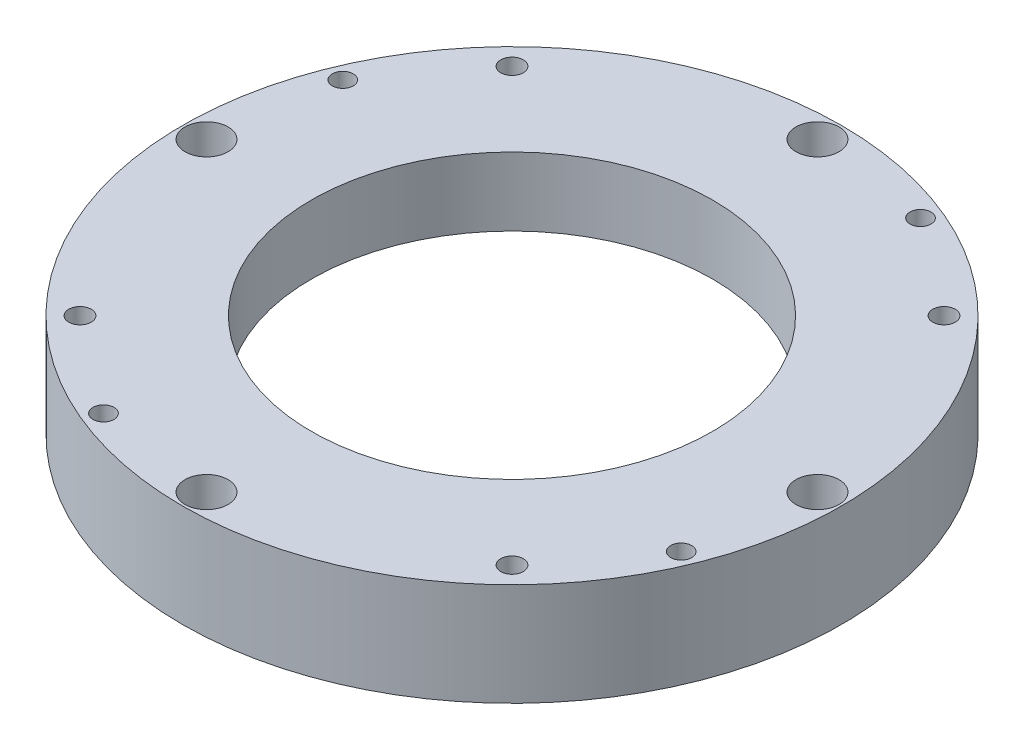
from build123d import *

# Parameters (mm, degrees)
SKETCH1_R           = 45.85
SKETCH1_R_2         = 1.5635
SKETCH1_R_3         = 39.5
BOSS_EXTRUDE1_DEPTH = 4.7625
BOSS_EXTRUDE2_START = 4.7625
SKETCH1_4_R         = 45.85
SKETCH1_4_R_2       = 1.5635
SKETCH1_4_R_3       = 27.9
BOSS_EXTRUDE2_DEPTH = 4.7625
CUT_EXTRUDE2_DEPTH  = 4.7625
BOSS_EXTRUDE3_START = 4.7625
SKETCH3_R           = 45.85
SKETCH3_R_2         = 3
SKETCH3_R_3         = 27.9
SKETCH3_R_4         = 1.565
BOSS_EXTRUDE3_DEPTH = 4.7625
SKETCH6_R           = 1.46
CUT_EXTRUDE4_DEPTH  = 67.397120843


with BuildPart() as part:
    # Sketch1 → Boss-Extrude1 (new body)
    with BuildSketch(Plane(origin=(0, 0, 0), x_dir=(1, 0, 0), z_dir=(0, 1, 0))):
        Circle(SKETCH1_R)
        with Locations((-30.0520382, -30.0520382)):
            Circle(SKETCH1_R_2, mode=Mode.SUBTRACT)
        with Locations((0, -42.5)):
            Circle(SKETCH1_R_2, mode=Mode.SUBTRACT)
        with Locations((30.0520382, -30.0520382)):
            Circle(SKETCH1_R_2, mode=Mode.SUBTRACT)
        with Locations((-42.5, 0)):
            Circle(SKETCH1_R_2, mode=Mode.SUBTRACT)
        with Locations((-30.0520382, 30.0520382)):
            Circle(SKETCH1_R_2, mode=Mode.SUBTRACT)
        Circle(SKETCH1_R_3, mode=Mode.SUBTRACT)
        with Locations((42.5, 0)):
            Circle(SKETCH1_R_2, mode=Mode.SUBTRACT)
        with Locations((0, 42.5)):
            Circle(SKETCH1_R_2, mode=Mode.SUBTRACT)
        with Locations((30.0520382, 30.0520382)):
            Circle(SKETCH1_R_2, mode=Mode.SUBTRACT)
    extrude(amount=-BOSS_EXTRUDE1_DEPTH)

    # Sketch1<4> → Boss-Extrude2 (add)
    with BuildSketch(Plane(origin=(0, 0, 0), x_dir=(1, 0, 0), z_dir=(0, 1, 0)).offset(BOSS_EXTRUDE2_START)):
        Circle(SKETCH1_4_R)
        with Locations((-30.0520382, -30.0520382)):
            Circle(SKETCH1_4_R_2, mode=Mode.SUBTRACT)
        with Locations((0, -42.5)):
            Circle(SKETCH1_4_R_2, mode=Mode.SUBTRACT)
        with Locations((30.0520382, -30.0520382)):
            Circle(SKETCH1_4_R_2, mode=Mode.SUBTRACT)
        with Locations((-42.5, 0)):
            Circle(SKETCH1_4_R_2, mode=Mode.SUBTRACT)
        with Locations((-30.0520382, 30.0520382)):
            Circle(SKETCH1_4_R_2, mode=Mode.SUBTRACT)
        with Locations((42.5, 0)):
            Circle(SKETCH1_4_R_2, mode=Mode.SUBTRACT)
        with Locations((0, 42.5)):
            Circle(SKETCH1_4_R_2, mode=Mode.SUBTRACT)
        with Locations((30.0520382, 30.0520382)):
            Circle(SKETCH1_4_R_2, mode=Mode.SUBTRACT)
        Circle(SKETCH1_4_R_3, mode=Mode.SUBTRACT)
    extrude(amount=-BOSS_EXTRUDE2_DEPTH)

    # Sketch4 → Cut-Extrude2 (cut)
    with BuildSketch(Plane(origin=(0, 4.7625, 0), x_dir=(1, 0, 0), z_dir=(0, 1, 0))):
        Polygon((28.493192474, -27.3520382), (26.934346747, -30.0520382), (28.493192474, -32.7520382), (31.610883927, -32.7520382), (33.169729654, -30.0520382), (31.610883927, -27.3520382), align=None)
        Polygon((30.0520382, 33.169729654), (27.3520382, 31.610883927), (27.3520382, 28.493192474), (30.0520382, 26.934346747), (32.7520382, 28.493192474), (32.7520382, 31.610883927), align=None)
        Polygon((-27.3520382, -28.493192474), (-30.0520382, -26.934346747), (-32.7520382, -28.493192474), (-32.7520382, -31.610883927), (-30.0520382, -33.169729654), (-27.3520382, -31.610883927), align=None)
        Polygon((-28.493192474, 27.3520382), (-26.934346747, 30.0520382), (-28.493192474, 32.7520382), (-31.610883927, 32.7520382), (-33.169729654, 30.0520382), (-31.610883927, 27.3520382), align=None)
    extrude(amount=-CUT_EXTRUDE2_DEPTH, mode=Mode.SUBTRACT)

    # Sketch3 → Boss-Extrude3 (add)
    with BuildSketch(Plane(origin=(0, 4.7625, 0), x_dir=(1, 0, 0), z_dir=(0, 1, 0)).offset(BOSS_EXTRUDE3_START)):
        Circle(SKETCH3_R)
        with Locations((0, -42.5)):
            Circle(SKETCH3_R_2, mode=Mode.SUBTRACT)
        with Locations((-42.5, 0)):
            Circle(SKETCH3_R_2, mode=Mode.SUBTRACT)
        Circle(SKETCH3_R_3, mode=Mode.SUBTRACT)
        with Locations((42.5, 0)):
            Circle(SKETCH3_R_2, mode=Mode.SUBTRACT)
        with Locations((0, 42.5)):
            Circle(SKETCH3_R_2, mode=Mode.SUBTRACT)
        with Locations((-30.0520382, -30.0520382)):
            Circle(SKETCH3_R_4, mode=Mode.SUBTRACT)
        with Locations((30.0520382, -30.0520382)):
            Circle(SKETCH3_R_4, mode=Mode.SUBTRACT)
        with Locations((-30.0520382, 30.0520382)):
            Circle(SKETCH3_R_4, mode=Mode.SUBTRACT)
        with Locations((30.0520382, 30.0520382)):
            Circle(SKETCH3_R_4, mode=Mode.SUBTRACT)
    extrude(amount=-BOSS_EXTRUDE3_DEPTH)

    # Sketch6 → Cut-Extrude4 (cut, through all)
    with BuildSketch(Plane(origin=(0, 9.525, 0), x_dir=(1, 0, 0), z_dir=(0, 1, 0))):
        with Locations((-40.188759664, 16.646729308)):
            Circle(SKETCH6_R)
        with Locations((16.646729308, 40.188759664)):
            Circle(SKETCH6_R)
        with Locations((40.188759664, -16.646729308)):
            Circle(SKETCH6_R)
        with Locations((-16.646729308, -40.188759664)):
            Circle(SKETCH6_R)
    extrude(amount=-CUT_EXTRUDE4_DEPTH, mode=Mode.SUBTRACT)


solid = part.part
